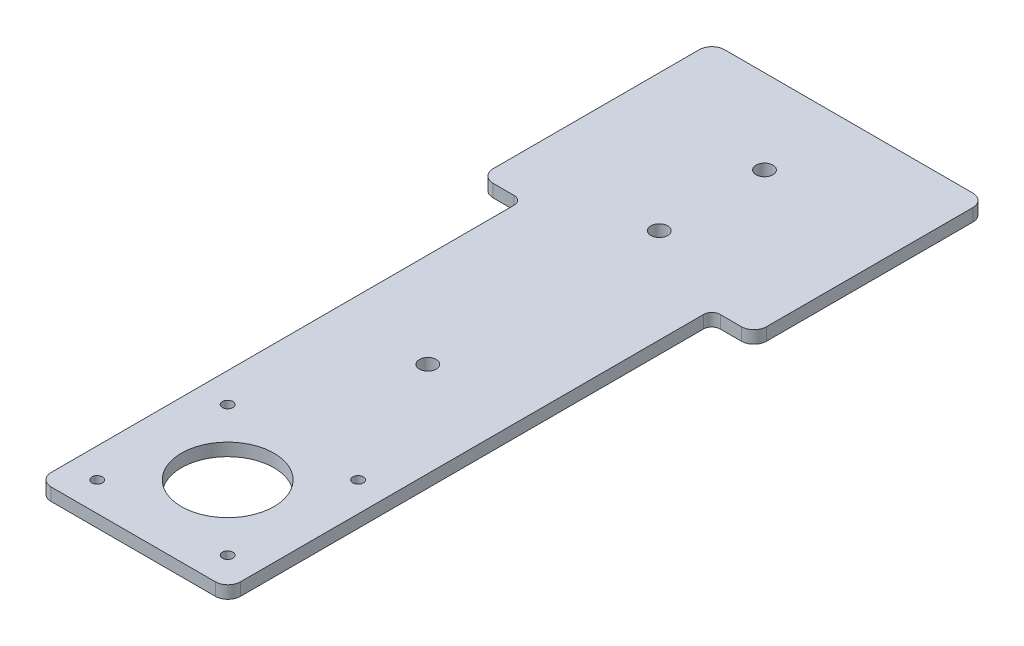
from build123d import *

# Parameters (mm, degrees)
SKETCH1_R           = 2
SKETCH1_R_2         = 1.25
SKETCH1_R_3         = 11
BOSS_EXTRUDE1_DEPTH = 3
FILLET1_R           = 3
FILLET2_R           = 3
FILLET3_R           = 3
FILLET4_R           = 3
FILLET5_R           = 3
FILLET7_R           = 3
FILLET8_R           = 2
FILLET9_R           = 2


with BuildPart() as part:
    # Sketch1 → Boss-Extrude1 (new body)
    with BuildSketch(Plane(origin=(0, 0, 0), x_dir=(1, 0, 0), z_dir=(0, 1, 0))):
        Polygon((0, 111.61362417), (-32.5, 111.61362417), (-32.5, 56.61362417), (-22.5, 56.61362417), (-22.5, -58.38637583), (0, -58.38637583), (22.5, -58.38637583), (22.5, 56.61362417), (32.5, 56.61362417), (32.5, 111.61362417), align=None)
        with Locations(Location((0, 91.61362417, 0), (0, 0, 270))):
            Circle(SKETCH1_R, mode=Mode.SUBTRACT)
        with Locations(Location((0, 66.61362417, 0), (0, 0, 270))):
            Circle(SKETCH1_R, mode=Mode.SUBTRACT)
        with Locations(Location((-15.5, -20.454039675, 0), (0, 0, 270))):
            Circle(SKETCH1_R_2, mode=Mode.SUBTRACT)
        with Locations(Location((-15.5, -51.454039675, 0), (0, 0, 270))):
            Circle(SKETCH1_R_2, mode=Mode.SUBTRACT)
        with Locations(Location((15.5, -51.454039675, 0), (0, 0, 270))):
            Circle(SKETCH1_R_2, mode=Mode.SUBTRACT)
        with Locations(Location((15.5, -20.454039675, 0), (0, 0, 270))):
            Circle(SKETCH1_R_2, mode=Mode.SUBTRACT)
        with Locations(Location((0, -35.954039675, 0), (0, 0, 270))):
            Circle(SKETCH1_R_3, mode=Mode.SUBTRACT)
        with Locations(Location((0, 11.61362417, 0), (0, 0, 270))):
            Circle(SKETCH1_R, mode=Mode.SUBTRACT)
    extrude(amount=BOSS_EXTRUDE1_DEPTH)

    # Fillet1
    fillet1_edges = [part.edges().sort_by_distance(p)[0] for p in [
        (32.5, 1.5, -111.61362417),
    ]]
    fillet(fillet1_edges, radius=FILLET1_R)

    # Fillet2
    fillet2_edges = [part.edges().sort_by_distance(p)[0] for p in [
        (-32.5, 1.5, -111.61362417),
    ]]
    fillet(fillet2_edges, radius=FILLET2_R)

    # Fillet3
    fillet3_edges = [part.edges().sort_by_distance(p)[0] for p in [
        (-32.5, 1.5, -56.61362417),
    ]]
    fillet(fillet3_edges, radius=FILLET3_R)

    # Fillet4
    fillet4_edges = [part.edges().sort_by_distance(p)[0] for p in [
        (32.5, 1.5, -56.61362417),
    ]]
    fillet(fillet4_edges, radius=FILLET4_R)

    # Fillet5
    fillet5_edges = [part.edges().sort_by_distance(p)[0] for p in [
        (22.5, 1.5, 58.38637583),
    ]]
    fillet(fillet5_edges, radius=FILLET5_R)

    # Fillet7
    fillet7_edges = [part.edges().sort_by_distance(p)[0] for p in [
        (-22.5, 1.5, 58.38637583),
    ]]
    fillet(fillet7_edges, radius=FILLET7_R)

    # Fillet8
    fillet8_edges = [part.edges().sort_by_distance(p)[0] for p in [
        (-22.5, 1.5, -56.61362417),
    ]]
    fillet(fillet8_edges, radius=FILLET8_R)

    # Fillet9
    fillet9_edges = [part.edges().sort_by_distance(p)[0] for p in [
        (22.5, 1.5, -56.61362417),
    ]]
    fillet(fillet9_edges, radius=FILLET9_R)


solid = part.part
